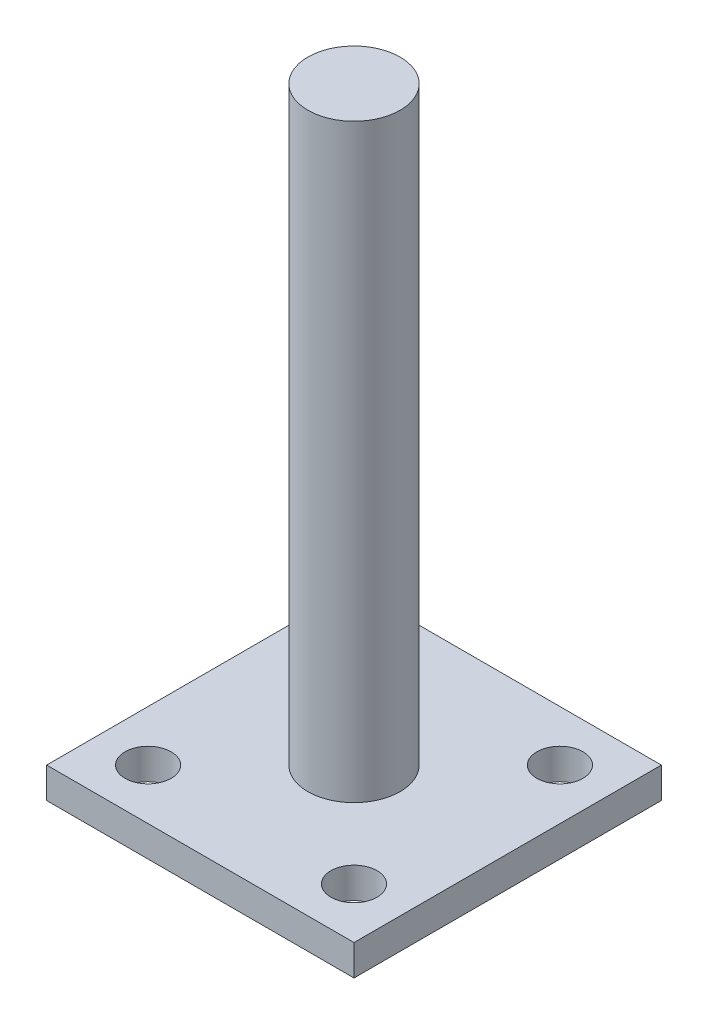
from build123d import *

# Parameters (mm, degrees)
SKETCH1_W           = 100
SKETCH1_H           = 100
SKETCH1_R           = 7.5
BOSS_EXTRUDE1_DEPTH = 10
SKETCH2_R           = 15
BOSS_EXTRUDE2_DEPTH = 192


with BuildPart() as part:
    # Sketch1 → Boss-Extrude1 (new body)
    with BuildSketch(Plane(origin=(0, 0, 0), x_dir=(1, 0, 0), z_dir=(0, 1, 0))):
        Rectangle(SKETCH1_W, SKETCH1_H)
        with Locations(Location((33.5, 33.5, 0), (0, 0, 270))):
            Circle(SKETCH1_R, mode=Mode.SUBTRACT)
        with Locations(Location((-33.5, 33.5, 0), (0, 0, 270))):
            Circle(SKETCH1_R, mode=Mode.SUBTRACT)
        with Locations(Location((-33.5, -33.5, 0), (0, 0, 270))):
            Circle(SKETCH1_R, mode=Mode.SUBTRACT)
        with Locations(Location((33.5, -33.5, 0), (0, 0, 270))):
            Circle(SKETCH1_R, mode=Mode.SUBTRACT)
    extrude(amount=BOSS_EXTRUDE1_DEPTH)

    # Sketch2 → Boss-Extrude2 (add)
    with BuildSketch(Plane(origin=(0, 10, 0), x_dir=(1, 0, 0), z_dir=(0, 1, 0))):
        with Locations(Location((0, 0, 0), (0, 0, 270))):
            Circle(SKETCH2_R)
    extrude(amount=BOSS_EXTRUDE2_DEPTH)


solid = part.part
